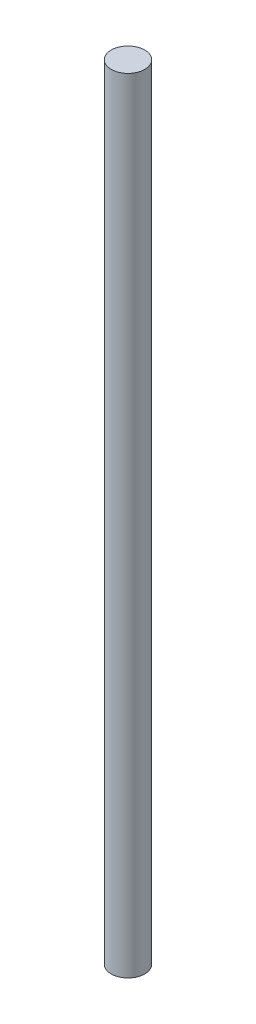
from build123d import *

# Parameters (mm, degrees)
SKETCH_1_R      = 3
EXTRUDE_1_DEPTH = 140


with BuildPart() as part:
    # Эскиз1 → Бобышка-Вытянуть1 (new body)
    with BuildSketch(Plane(origin=(0, 0, 0), x_dir=(1, 0, 0), z_dir=(0, 1, 0))):
        with Locations(Location((0, 0, 0), (0, 0, 270))):
            Circle(SKETCH_1_R)
    extrude(amount=EXTRUDE_1_DEPTH)


solid = part.part
